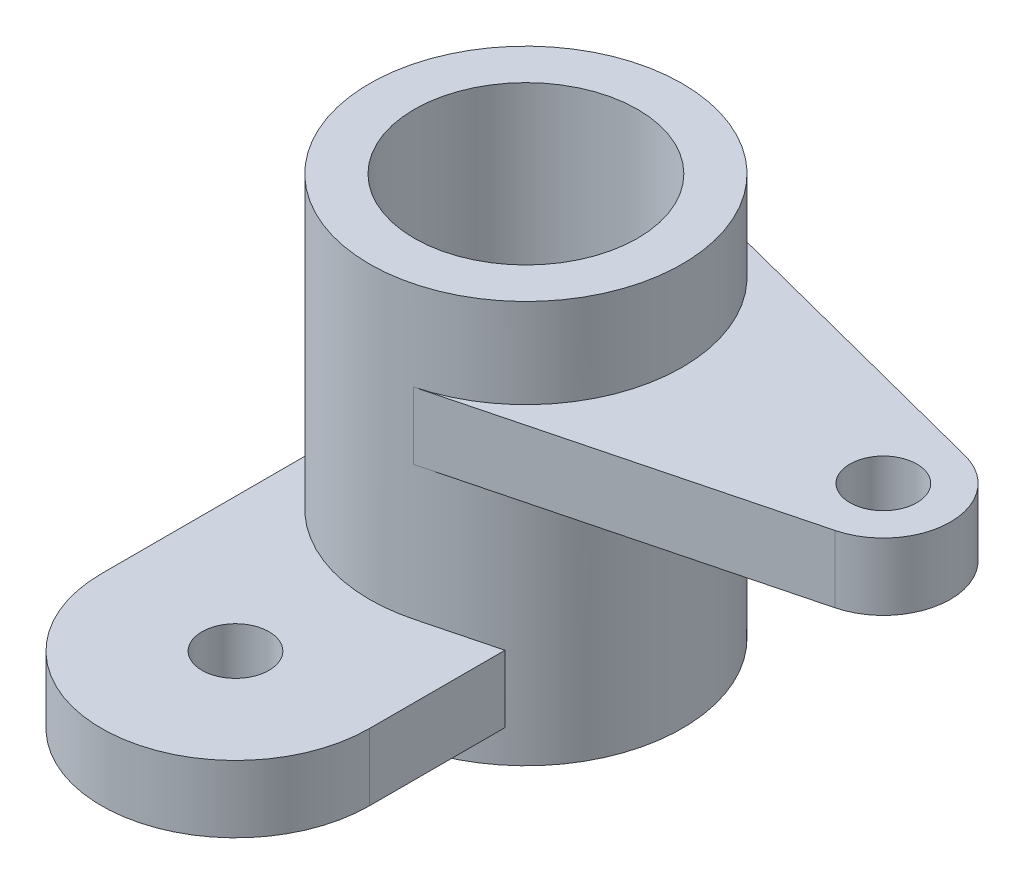
from build123d import *

# Parameters (mm, degrees)
SKETCH1_R           = 25
BOSS_EXTRUDE1_DEPTH = 90
BOSS_EXTRUDE2_START = -20
SKETCH1_3_R         = 7.5
BOSS_EXTRUDE2_DEPTH = 15
BOSS_EXTRUDE3_START = -65
SKETCH1_4_R         = 7.5
BOSS_EXTRUDE3_DEPTH = 15


with BuildPart() as part:
    # Sketch1 → Boss-Extrude1 (new body)
    with BuildSketch(Plane(origin=(0, 0, 0), x_dir=(1, 0, 0), z_dir=(0, 1, 0))):
        with BuildLine():
            ThreePointArc((8.75, -33.888604279), (17.516451042, -30.301385165), (25, -24.494897428))
            ThreePointArc((25, -24.494897428), (32.403703492, -13.228756555), (35, 0))
            ThreePointArc((35, 0), (27.669929526, 21.433035249), (8.75, 33.888604279))
            ThreePointArc((8.75, 33.888604279), (-21.433035249, 27.669929526), (-35, 0))
            ThreePointArc((-35, 0), (-21.433035249, -27.669929526), (8.75, -33.888604279))
        make_face()
        Circle(SKETCH1_R, mode=Mode.SUBTRACT)
    extrude(amount=-BOSS_EXTRUDE1_DEPTH)

    # Sketch1<3> → Boss-Extrude2 (add)
    with BuildSketch(Plane(origin=(0, 0, 0), x_dir=(1, 0, 0), z_dir=(0, 1, 0)).offset(BOSS_EXTRUDE2_START)):
        with BuildLine():
            Line((8.75, -33.888604279), (83.75, -14.523687548))
            ThreePointArc((83.75, -14.523687548), (95, 0), (83.75, 14.523687548))
            Line((83.75, 14.523687548), (8.75, 33.888604279))
            ThreePointArc((8.75, 33.888604279), (35, 0), (8.75, -33.888604279))
        make_face()
        with Locations((80, 0)):
            Circle(SKETCH1_3_R, mode=Mode.SUBTRACT)
    extrude(amount=-BOSS_EXTRUDE2_DEPTH)

    # Sketch1<4> → Boss-Extrude3 (add)
    with BuildSketch(Plane(origin=(0, 0, 0), x_dir=(1, 0, 0), z_dir=(0, 1, 0)).offset(BOSS_EXTRUDE3_START)):
        with BuildLine():
            ThreePointArc((-35, -60), (-5, -90), (25, -60))
            Line((25, -60), (25, -29.692872321))
            Line((25, -29.692872321), (8.75, -33.888604279))
            ThreePointArc((8.75, -33.888604279), (-21.433035249, -27.669929526), (-35, 0))
            Line((-35, 0), (-35, -60))
        make_face()
        with Locations((-5, -60)):
            Circle(SKETCH1_4_R, mode=Mode.SUBTRACT)
    extrude(amount=-BOSS_EXTRUDE3_DEPTH)


solid = part.part
